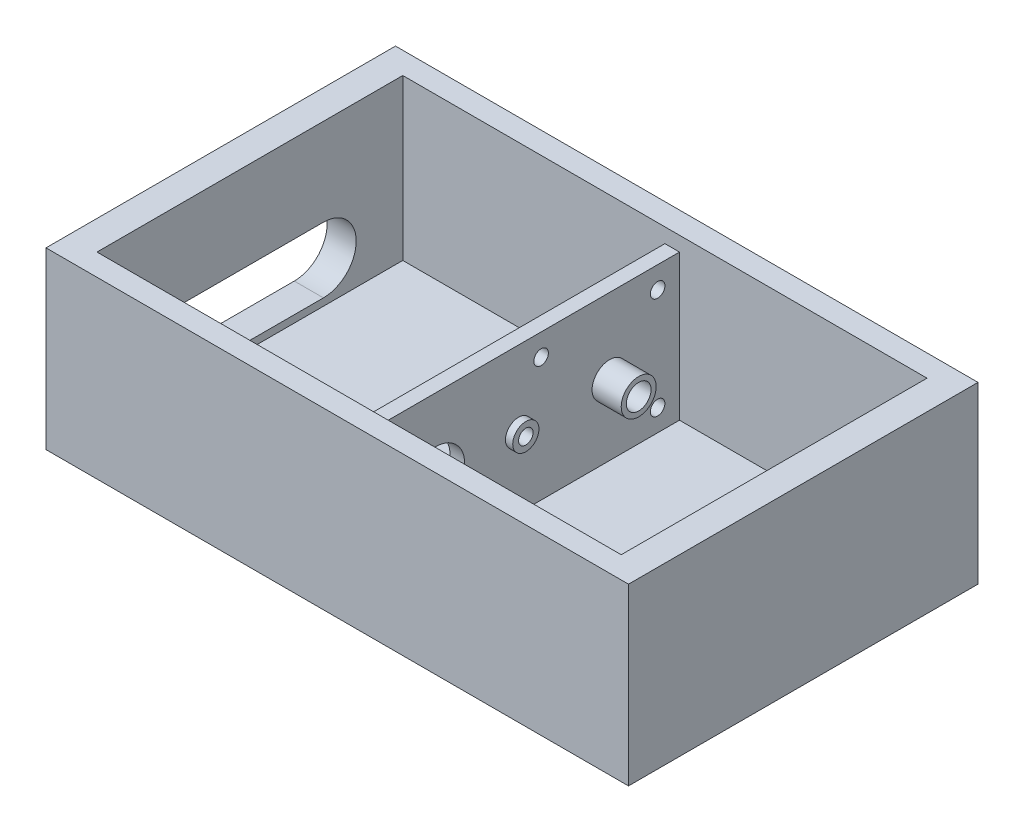
from build123d import *

# Parameters (mm, degrees)
SKETCH_2_W               = 24
SKETCH_2_H               = 12
EXTRUDE_1_DEPTH          = 40
SKETCH_3_W               = 36
SKETCH_3_H               = 21
CUT_EXTRUDE_1_DEPTH      = 11
CUT_EXTRUDE_2_DEPTH      = 2
SKETCH_7_W               = 1
SKETCH_7_H               = 21
EXTRUDE_4_DEPTH          = 10
SKETCH_8_R               = 0.85
CUT_EXTRUDE_3_DEPTH      = 3
SKETCH_9_R               = 1.2
EXTRUDE_5_DEPTH          = 2
CUT_EXTRUDE_START        = -2
SKETCH_10_R              = 0.85
CUT_EXTRUDE_4_DEPTH      = 2
SKETCH_11_R              = 0.9
EXTRUDE_6_DEPTH          = 0.5
CUT_EXTRUDE_5_DEPTH      = 17
CUT_EXTRUDE_5_DEPTH_BACK = 2
SKETCH_12_R              = 0.5
SKETCH_13_R              = 2
CUT_EXTRUDE_6_DEPTH      = 2
SKETCH_14_R              = 0.5
CUT_EXTRUDE_7_DEPTH      = 2


with BuildPart() as part:
    # 草图2 → 凸台-拉伸1 (new body)
    with BuildSketch(Plane(origin=(0, 0, 0), x_dir=(0, 0, -1), z_dir=(1, 0, 0))):
        Rectangle(SKETCH_2_W, SKETCH_2_H)
    extrude(amount=EXTRUDE_1_DEPTH)

    # 草图3 → 切除-拉伸1 (cut)
    with BuildSketch(Plane(origin=(0, 6, 0), x_dir=(1, 0, 0), z_dir=(0, 1, 0))):
        with Locations((20, 0)):
            Rectangle(SKETCH_3_W, SKETCH_3_H)
    extrude(amount=-CUT_EXTRUDE_1_DEPTH, mode=Mode.SUBTRACT)

    # 草图4 → 切除-拉伸2 (cut)
    with BuildSketch(Plane.ZY):
        with BuildLine():
            Line((-5.05, 0), (6.45, 0))
            ThreePointArc((6.45, 0), (8.7, -2.25), (6.45, -4.5))
            Line((6.45, -4.5), (-5.05, -4.5))
            ThreePointArc((-5.05, -4.5), (-7.3, -2.25), (-5.05, 0))
        make_face()
    extrude(amount=-CUT_EXTRUDE_2_DEPTH, mode=Mode.SUBTRACT)

    # 草图7 → 凸台-拉伸4 (add)
    with BuildSketch(Plane(origin=(0, -5, 0), x_dir=(1, 0, 0), z_dir=(0, 1, 0))):
        with Locations((20.5, 0)):
            Rectangle(SKETCH_7_W, SKETCH_7_H)
    extrude(amount=EXTRUDE_4_DEPTH)

    # 草图8 → 切除-拉伸3 (cut)
    with BuildSketch(Plane.ZY.offset(-20)):
        with Locations((-5.7, -0.2)):
            Circle(SKETCH_8_R)
    extrude(amount=-CUT_EXTRUDE_3_DEPTH, mode=Mode.SUBTRACT)

    # 草图9 → 凸台-拉伸5 (add)
    with BuildSketch(Plane(origin=(21, 0, 0), x_dir=(0, 0, -1), z_dir=(1, 0, 0))):
        with Locations(Location((5.7, -0.2, 0), (0, 0, 180))):
            Circle(SKETCH_9_R)
    extrude(amount=EXTRUDE_5_DEPTH)

    # 草图10 → 切除-拉伸4 (cut)
    with BuildSketch(Plane(origin=(23, 0, 0), x_dir=(0, 0, -1), z_dir=(1, 0, 0)).offset(CUT_EXTRUDE_START)):
        with Locations(Location((5.7, -0.2, 0), (0, 0, 180))):
            Circle(SKETCH_10_R)
    extrude(amount=CUT_EXTRUDE_4_DEPTH, mode=Mode.SUBTRACT)

    # 草图11 → 凸台-拉伸6 (add)
    with BuildSketch(Plane(origin=(21, 0, 0), x_dir=(0, 0, -1), z_dir=(1, 0, 0))):
        with Locations(Location((-0.55, -0.2, 0), (0, 0, 180))):
            Circle(SKETCH_11_R)
    extrude(amount=EXTRUDE_6_DEPTH)

    # 草图12 → 切除-拉伸5 (cut, two sides: drawn at the far end of the back side and taken through both)
    with BuildSketch(Plane(origin=(21.5, 0, 0), x_dir=(0, 0, -1), z_dir=(1, 0, 0)).offset(-CUT_EXTRUDE_5_DEPTH_BACK)):
        with Locations((-0.55, -0.2)):
            Circle(SKETCH_12_R)
    extrude(amount=CUT_EXTRUDE_5_DEPTH + CUT_EXTRUDE_5_DEPTH_BACK, mode=Mode.SUBTRACT)

    # 草图13 → 切除-拉伸6 (cut)
    with BuildSketch(Plane(origin=(21, 0, 0), x_dir=(0, 0, -1), z_dir=(1, 0, 0))):
        with Locations((-6.25, -0.2)):
            Circle(SKETCH_13_R)
    extrude(amount=-CUT_EXTRUDE_6_DEPTH, mode=Mode.SUBTRACT)

    # 草图14 → 切除-拉伸7 (cut)
    with BuildSketch(Plane(origin=(21, 0, 0), x_dir=(0, 0, -1), z_dir=(1, 0, 0))):
        with Locations((9, -3.5)):
            Circle(SKETCH_14_R)
        with Locations((9, 3.5)):
            Circle(SKETCH_14_R)
        with Locations((1, 3.5)):
            Circle(SKETCH_14_R)
    extrude(amount=-CUT_EXTRUDE_7_DEPTH, mode=Mode.SUBTRACT)


solid = part.part
